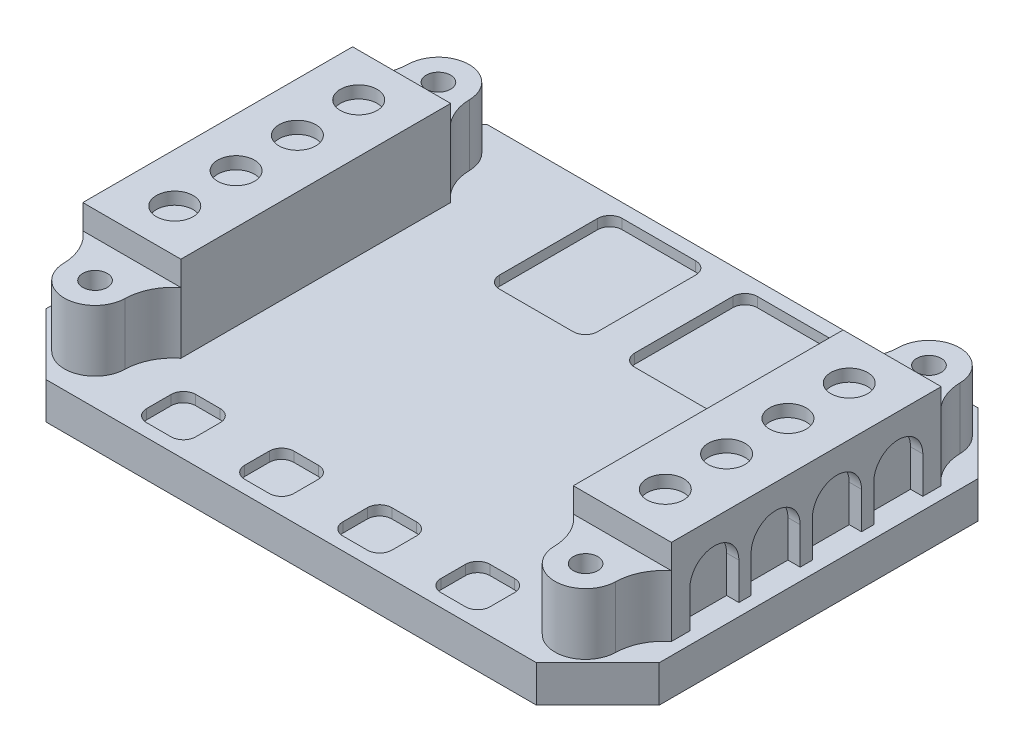
from build123d import *

# Parameters (mm, degrees)
SALIENTE_EXTRUIR1_DEPTH = 3
CROQUIS2_R              = 1
SALIENTE_EXTRUIR2_DEPTH = 7
CROQUIS3_W              = 8.584431172
CROQUIS3_H              = 6.245278734
CROQUIS3_W_2            = 9.103782271
CROQUIS3_H_2            = 6.523642819
CORTAR_EXTRUIR1_DEPTH   = 2
CROQUIS4_R              = 1.5
CORTAR_EXTRUIR2_DEPTH   = 1
CORTAR_EXTRUIR3_DEPTH   = 1
CORTAR_EXTRUIR4_DEPTH   = 0.8


with BuildPart() as part:
    # Croquis1 → Saliente-Extruir1 (new body)
    with BuildSketch(Plane(origin=(0, 0, 0), x_dir=(1, 0, 0), z_dir=(0, 1, 0))):
        Polygon((-25, -13), (-20, -18), (20, -18), (25, -13), (25, 13), (20, 18), (-20, 18), (-25, 13), align=None)
    extrude(amount=SALIENTE_EXTRUIR1_DEPTH)

    # Croquis2 → Saliente-Extruir2 (add)
    with BuildSketch(Plane(origin=(0, 3, 0), x_dir=(1, 0, 0), z_dir=(0, 1, 0))):
        with BuildLine():
            Line((-24, 11), (-24, -11))
            ThreePointArc((-24, -11), (-22.910217487, -12.356554061), (-22.499549169, -14.047475815))
            ThreePointArc((-22.499549169, -14.047475815), (-20, -16.5), (-17.500450831, -14.047475815))
            ThreePointArc((-17.500450831, -14.047475815), (-17.089782513, -12.356554061), (-16, -11))
            Line((-16, -11), (-16, 11))
            ThreePointArc((-16, 11), (-17.089782513, 12.356554061), (-17.500450831, 14.047475815))
            ThreePointArc((-17.500450831, 14.047475815), (-20, 16.5), (-22.499549169, 14.047475815))
            ThreePointArc((-22.499549169, 14.047475815), (-22.910217487, 12.356554061), (-24, 11))
        make_face()
        with Locations(Location((-20, -14, 0), (0, 0, 270))):
            Circle(CROQUIS2_R, mode=Mode.SUBTRACT)
        with Locations(Location((-20, 14, 0), (0, 0, 90))):
            Circle(CROQUIS2_R, mode=Mode.SUBTRACT)
    saliente_extruir2 = extrude(amount=SALIENTE_EXTRUIR2_DEPTH)

    # Croquis3 → Cortar-Extruir1 (cut)
    with BuildSketch(Plane(origin=(0, 10, 0), x_dir=(1, 0, 0), z_dir=(0, 1, 0))):
        with Locations((-19.707784414, -14.122639367)):
            Rectangle(CROQUIS3_W, CROQUIS3_H)
        with Locations((-20.551891136, 14.26182141)):
            Rectangle(CROQUIS3_W_2, CROQUIS3_H_2)
    cortar_extruir1 = extrude(amount=-CORTAR_EXTRUIR1_DEPTH, mode=Mode.SUBTRACT)

    # Croquis4 → Cortar-Extruir2 (cut)
    with BuildSketch(Plane(origin=(0, 10, 0), x_dir=(1, 0, 0), z_dir=(0, 1, 0))):
        with Locations(Location((-20, 7.5, 0), (0, 0, 270))):
            Circle(CROQUIS4_R)
        with Locations(Location((-20, 2.5, 0), (0, 0, 270))):
            Circle(CROQUIS4_R)
        with Locations(Location((-20, -2.5, 0), (0, 0, 270))):
            Circle(CROQUIS4_R)
        with Locations(Location((-20, -7.5, 0), (0, 0, 270))):
            Circle(CROQUIS4_R)
    cortar_extruir2 = extrude(amount=-CORTAR_EXTRUIR2_DEPTH, mode=Mode.SUBTRACT)

    # Croquis5 → Cortar-Extruir3 (cut)
    with BuildSketch(Plane.ZY.offset(24)):
        with BuildLine():
            Line((-9.5, 6), (-9.5, 3))
            Line((-9.5, 3), (-5.5, 3))
            Line((-5.5, 3), (-5.5, 6))
            ThreePointArc((-5.5, 6), (-7.5, 8), (-9.5, 6))
        make_face()
        with BuildLine():
            Line((-0.5, 3), (-0.5, 6))
            ThreePointArc((-0.5, 6), (-2.5, 8), (-4.5, 6))
            Line((-4.5, 6), (-4.5, 3))
            Line((-4.5, 3), (-0.5, 3))
        make_face()
        with BuildLine():
            Line((4.5, 3), (4.5, 6))
            ThreePointArc((4.5, 6), (2.5, 8), (0.5, 6))
            Line((0.5, 6), (0.5, 3))
            Line((0.5, 3), (4.5, 3))
        make_face()
        with BuildLine():
            Line((9.5, 3), (9.5, 6))
            ThreePointArc((9.5, 6), (7.5, 8), (5.5, 6))
            Line((5.5, 6), (5.5, 3))
            Line((5.5, 3), (9.5, 3))
        make_face()
    cortar_extruir3 = extrude(amount=-CORTAR_EXTRUIR3_DEPTH, mode=Mode.SUBTRACT)

    # Simetría1: Saliente-Extruir2, Cortar-Extruir1, Cortar-Extruir2, Cortar-Extruir3 across plane
    add(saliente_extruir2.mirror(Plane(origin=(0, 0, 0), x_dir=(0, 0, 1), z_dir=(1, 0, 0))))
    add(cortar_extruir1.mirror(Plane(origin=(0, 0, 0), x_dir=(0, 0, 1), z_dir=(1, 0, 0))), mode=Mode.SUBTRACT)
    add(cortar_extruir2.mirror(Plane(origin=(0, 0, 0), x_dir=(0, 0, 1), z_dir=(1, 0, 0))), mode=Mode.SUBTRACT)
    add(cortar_extruir3.mirror(Plane(origin=(0, 0, 0), x_dir=(0, 0, 1), z_dir=(1, 0, 0))), mode=Mode.SUBTRACT)

    # Croquis6 → Cortar-Extruir4 (cut)
    with BuildSketch(Plane(origin=(0, 3, 0), x_dir=(1, 0, 0), z_dir=(0, 1, 0))):
        with BuildLine():
            Line((-4.849514856, -12.944900329), (-2.849514856, -12.944900329))
            ThreePointArc((-2.849514856, -12.944900329), (-2.142408074, -13.237793547), (-1.849514856, -13.944900329))
            Line((-1.849514856, -13.944900329), (-1.849514856, -15.944900329))
            ThreePointArc((-1.849514856, -15.944900329), (-2.142408074, -16.65200711), (-2.849514856, -16.944900329))
            Line((-2.849514856, -16.944900329), (-4.849514856, -16.944900329))
            ThreePointArc((-4.849514856, -16.944900329), (-5.556621637, -16.65200711), (-5.849514856, -15.944900329))
            Line((-5.849514856, -15.944900329), (-5.849514856, -13.944900329))
            ThreePointArc((-5.849514856, -13.944900329), (-5.556621637, -13.237793547), (-4.849514856, -12.944900329))
        make_face()
        with BuildLine():
            Line((-7.889343155, 16.87305495), (-1.889343155, 16.87305495))
            ThreePointArc((-1.889343155, 16.87305495), (-1.182236374, 16.580161731), (-0.889343155, 15.87305495))
            Line((-0.889343155, 15.87305495), (-0.889343155, 7.87305495))
            ThreePointArc((-0.889343155, 7.87305495), (-1.182236374, 7.165948169), (-1.889343155, 6.87305495))
            Line((-1.889343155, 6.87305495), (-7.889343155, 6.87305495))
            ThreePointArc((-7.889343155, 6.87305495), (-8.596449936, 7.165948169), (-8.889343155, 7.87305495))
            Line((-8.889343155, 7.87305495), (-8.889343155, 15.87305495))
            ThreePointArc((-8.889343155, 15.87305495), (-8.596449936, 16.580161731), (-7.889343155, 16.87305495))
        make_face()
        with BuildLine():
            Line((3.130467216, 16.87305495), (9.130467216, 16.87305495))
            ThreePointArc((9.130467216, 16.87305495), (9.837573998, 16.580161731), (10.130467216, 15.87305495))
            Line((10.130467216, 15.87305495), (10.130467216, 7.87305495))
            ThreePointArc((10.130467216, 7.87305495), (9.837573998, 7.165948169), (9.130467216, 6.87305495))
            Line((9.130467216, 6.87305495), (3.130467216, 6.87305495))
            ThreePointArc((3.130467216, 6.87305495), (2.423360435, 7.165948169), (2.130467216, 7.87305495))
            Line((2.130467216, 7.87305495), (2.130467216, 15.87305495))
            ThreePointArc((2.130467216, 15.87305495), (2.423360435, 16.580161731), (3.130467216, 16.87305495))
        make_face()
        with BuildLine():
            Line((-12.849514856, -12.944900329), (-10.849514856, -12.944900329))
            ThreePointArc((-10.849514856, -12.944900329), (-10.142408074, -13.237793547), (-9.849514856, -13.944900329))
            Line((-9.849514856, -13.944900329), (-9.849514856, -15.944900329))
            ThreePointArc((-9.849514856, -15.944900329), (-10.142408074, -16.65200711), (-10.849514856, -16.944900329))
            Line((-10.849514856, -16.944900329), (-12.849514856, -16.944900329))
            ThreePointArc((-12.849514856, -16.944900329), (-13.556621637, -16.65200711), (-13.849514856, -15.944900329))
            Line((-13.849514856, -15.944900329), (-13.849514856, -13.944900329))
            ThreePointArc((-13.849514856, -13.944900329), (-13.556621637, -13.237793547), (-12.849514856, -12.944900329))
        make_face()
        with BuildLine():
            Line((3.150485144, -12.944900329), (5.150485144, -12.944900329))
            ThreePointArc((5.150485144, -12.944900329), (5.857591926, -13.237793547), (6.150485144, -13.944900329))
            Line((6.150485144, -13.944900329), (6.150485144, -15.944900329))
            ThreePointArc((6.150485144, -15.944900329), (5.857591926, -16.65200711), (5.150485144, -16.944900329))
            Line((5.150485144, -16.944900329), (3.150485144, -16.944900329))
            ThreePointArc((3.150485144, -16.944900329), (2.443378363, -16.65200711), (2.150485144, -15.944900329))
            Line((2.150485144, -15.944900329), (2.150485144, -13.944900329))
            ThreePointArc((2.150485144, -13.944900329), (2.443378363, -13.237793547), (3.150485144, -12.944900329))
        make_face()
        with BuildLine():
            Line((11.150485144, -12.944900329), (13.150485144, -12.944900329))
            ThreePointArc((13.150485144, -12.944900329), (13.857591926, -13.237793547), (14.150485144, -13.944900329))
            Line((14.150485144, -13.944900329), (14.150485144, -15.944900329))
            ThreePointArc((14.150485144, -15.944900329), (13.857591926, -16.65200711), (13.150485144, -16.944900329))
            Line((13.150485144, -16.944900329), (11.150485144, -16.944900329))
            ThreePointArc((11.150485144, -16.944900329), (10.443378363, -16.65200711), (10.150485144, -15.944900329))
            Line((10.150485144, -15.944900329), (10.150485144, -13.944900329))
            ThreePointArc((10.150485144, -13.944900329), (10.443378363, -13.237793547), (11.150485144, -12.944900329))
        make_face()
    extrude(amount=-CORTAR_EXTRUIR4_DEPTH, mode=Mode.SUBTRACT)


solid = part.part
